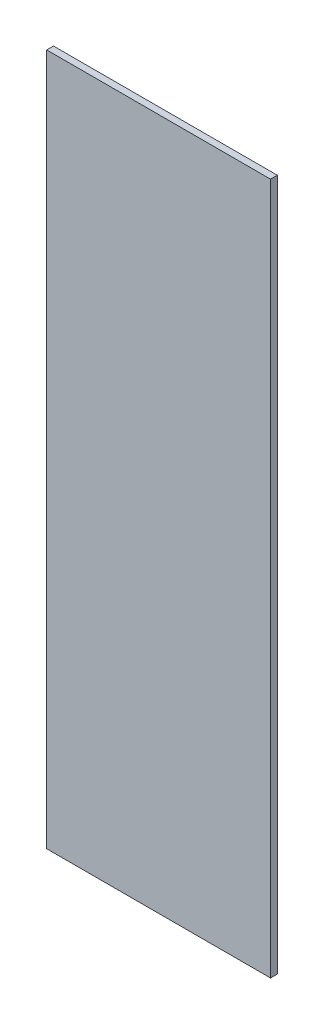
from build123d import *

# Parameters (mm, degrees)
SKETCH1_W           = 330
SKETCH1_H           = 1020
BOSS_EXTRUDE1_DEPTH = 5


with BuildPart() as part:
    # Sketch1 → Boss-Extrude1 (new, symmetric)
    with BuildSketch(Plane.XY):
        with Locations((1185, -740)):
            Rectangle(SKETCH1_W, SKETCH1_H)
    extrude(amount=BOSS_EXTRUDE1_DEPTH, both=True)


solid = part.part
